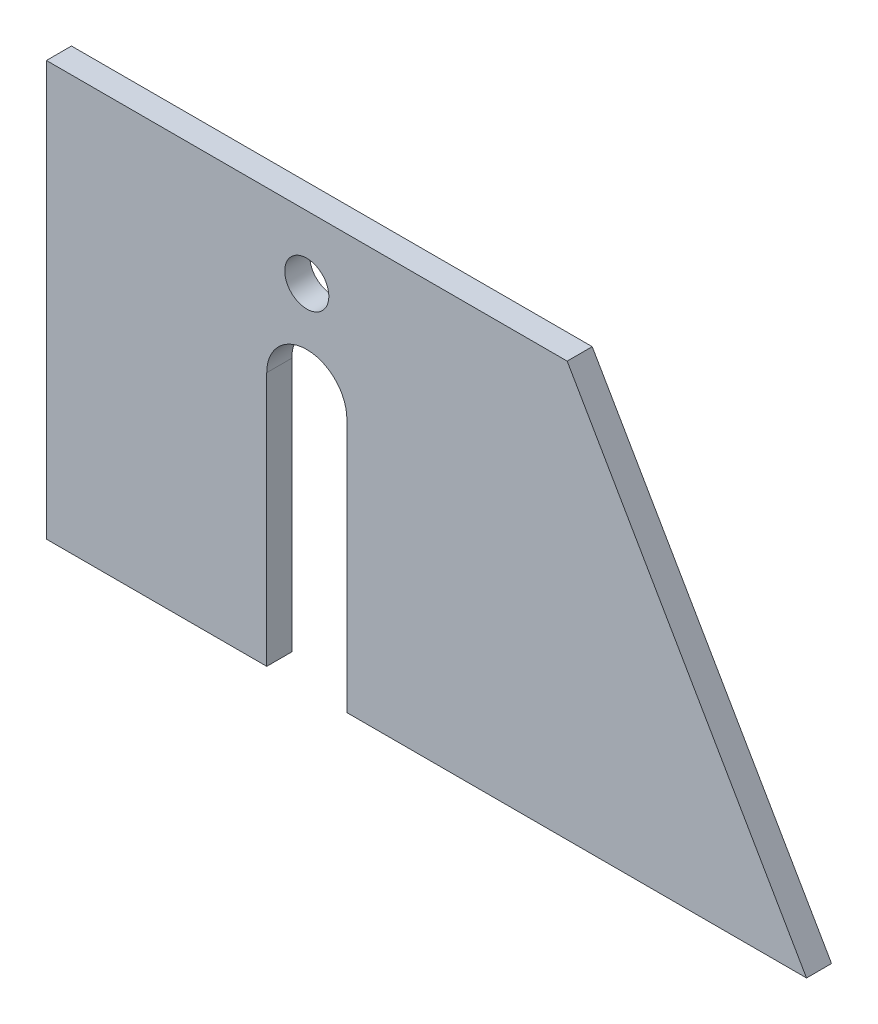
from build123d import *

# Parameters (mm, degrees)
SKETCH1_R           = 2.75
BOSS_EXTRUDE1_DEPTH = 3.125


with BuildPart() as part:
    # Sketch1 → Boss-Extrude1 (new body)
    with BuildSketch(Plane.XY):
        with BuildLine():
            Line((-32.5, 20), (32.5, 20))
            Line((32.5, 20), (62.377876431, -31.75))
            Line((62.377876431, -31.75), (32.5, -31.75))
            Line((32.5, -31.75), (5, -31.75))
            Line((5, -31.75), (5, 0))
            ThreePointArc((5, 0), (0, 5), (-5, 0))
            Line((-5, 0), (-5, -31.75))
            Line((-5, -31.75), (-32.5, -31.75))
            Line((-32.5, -31.75), (-32.5, 20))
        make_face()
        with Locations((0, 12.125)):
            Circle(SKETCH1_R, mode=Mode.SUBTRACT)
    extrude(amount=BOSS_EXTRUDE1_DEPTH)


solid = part.part
